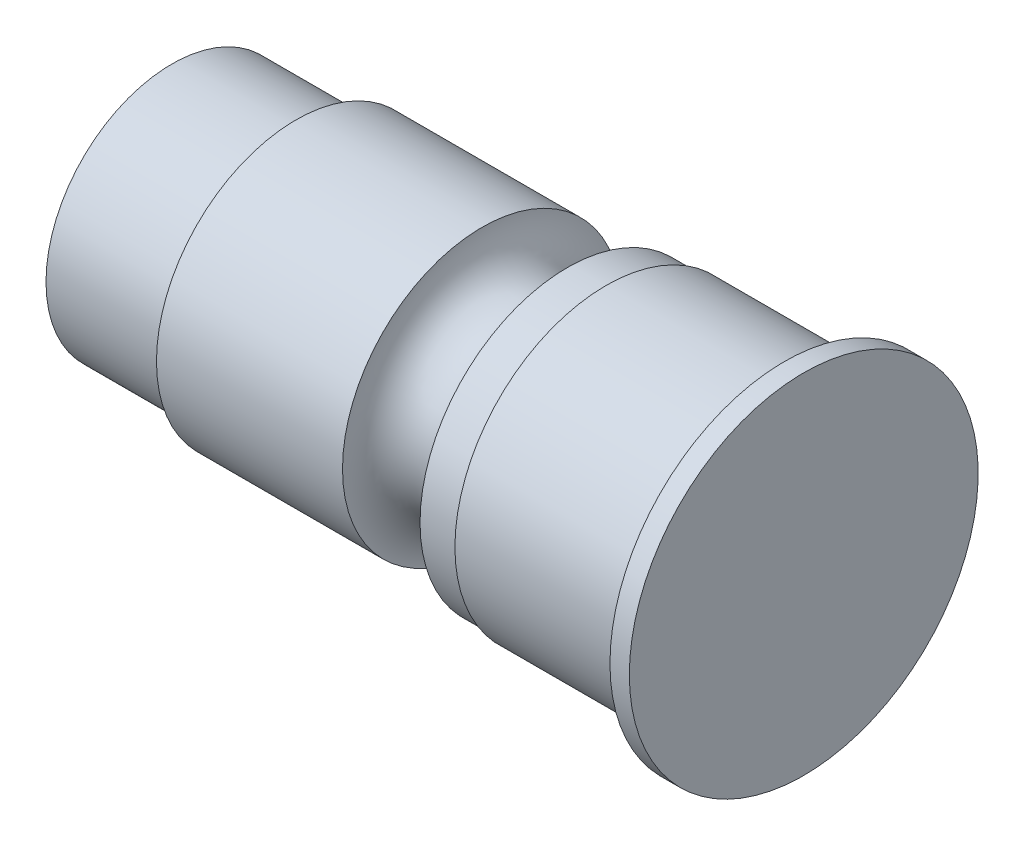
from build123d import *


with BuildPart() as part:
    # Sketch1 → Revolve1 (revolve)
    with BuildSketch(Plane(origin=(0, 0, 0), x_dir=(-1, 0, 0), z_dir=(0, 1, 0))):
        with BuildLine():
            Line((0, 0), (0, 45))
            Line((0, 45), (5, 45))
            Line((5, 45), (5, 39))
            Line((5, 39), (51, 39))
            Line((51, 39), (51, 38))
            Line((51, 38), (61, 38))
            Line((61, 38), (61, 36))
            ThreePointArc((61, 36), (72, 25), (83, 36))
            Line((83, 36), (131, 36))
            Line((131, 36), (131, 32.5))
            Line((131, 32.5), (163, 32.5))
            Line((163, 32.5), (163, 0))
            Line((163, 0), (0, 0))
        make_face()
    revolve(axis=Axis((-163, 0, 0), (1, 0, 0)))


solid = part.part
